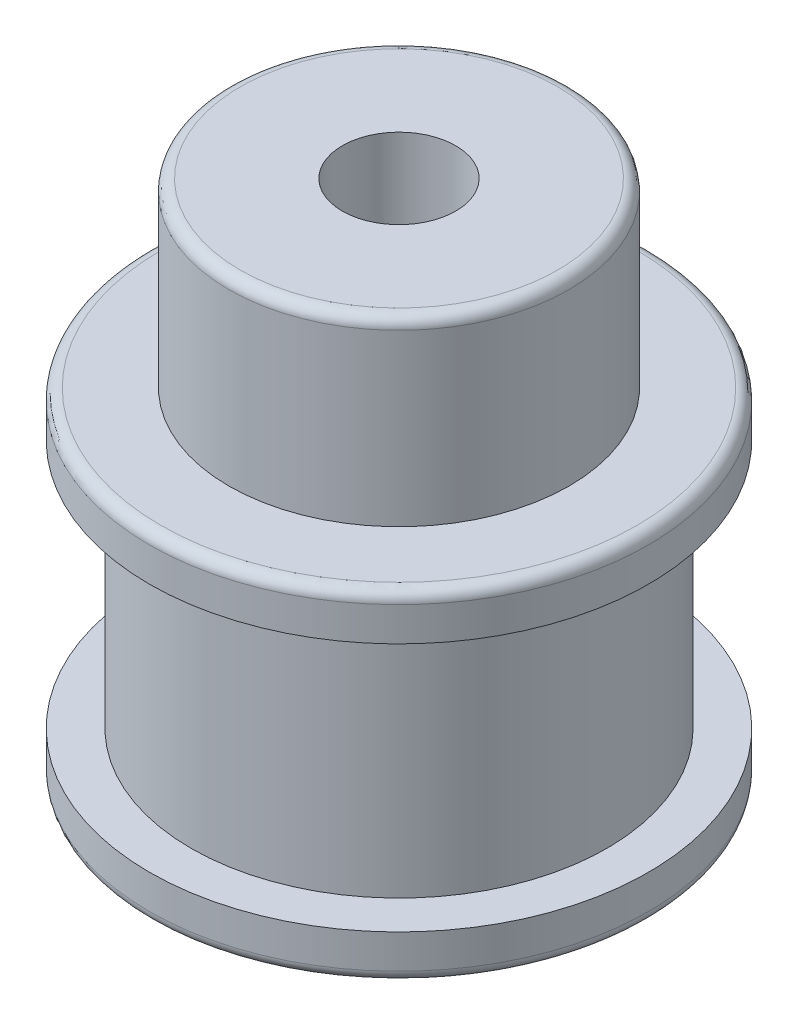
from build123d import *

# Parameters (mm, degrees)
SKETCH_1_R          = 11
SKETCH_1_R_2        = 2.5
EXTRUDE_1_DEPTH     = 15
SKETCH_2_R          = 7.5
SKETCH_2_R_2        = 2.5
EXTRUDE_2_DEPTH     = 8
CUT_EXTRUDE_START   = 2
SKETCH_3_R          = 11
SKETCH_3_R_2        = 9.17
CUT_EXTRUDE_1_DEPTH = 11
FILLET_1_R          = 0.5


with BuildPart() as part:
    # 草图1 → 凸台-拉伸1 (new body)
    with BuildSketch(Plane(origin=(0, 0, 0), x_dir=(1, 0, 0), z_dir=(0, 1, 0))):
        with Locations(Location((0, 0, 0), (0, 0, 270))):
            Circle(SKETCH_1_R)
        with Locations(Location((0, 0, 0), (0, 0, 270))):
            Circle(SKETCH_1_R_2, mode=Mode.SUBTRACT)
    extrude(amount=EXTRUDE_1_DEPTH)

    # 草图2 → 凸台-拉伸2 (add)
    with BuildSketch(Plane(origin=(0, 15, 0), x_dir=(1, 0, 0), z_dir=(0, 1, 0))):
        with Locations(Location((0, 0, 0), (0, 0, 270))):
            Circle(SKETCH_2_R)
        with Locations(Location((0, 0, 0), (0, 0, 270))):
            Circle(SKETCH_2_R_2, mode=Mode.SUBTRACT)
    extrude(amount=EXTRUDE_2_DEPTH)

    # 草图3 → 切除-拉伸1 (cut)
    with BuildSketch(Plane(origin=(0, 0, 0), x_dir=(1, 0, 0), z_dir=(0, 1, 0)).offset(CUT_EXTRUDE_START)):
        with Locations(Location((0, 0, 0), (0, 0, 270))):
            Circle(SKETCH_3_R)
        with Locations(Location((0, 0, 0), (0, 0, 270))):
            Circle(SKETCH_3_R_2, mode=Mode.SUBTRACT)
    extrude(amount=CUT_EXTRUDE_1_DEPTH, mode=Mode.SUBTRACT)

    # 圆角1
    fillet_1_edges = [part.edges().sort_by_distance(p)[0] for p in [
        (0, 0, -11),
        (0, 15, -11),
        (0, 23, -7.5),
    ]]
    fillet(fillet_1_edges, radius=FILLET_1_R)


solid = part.part
